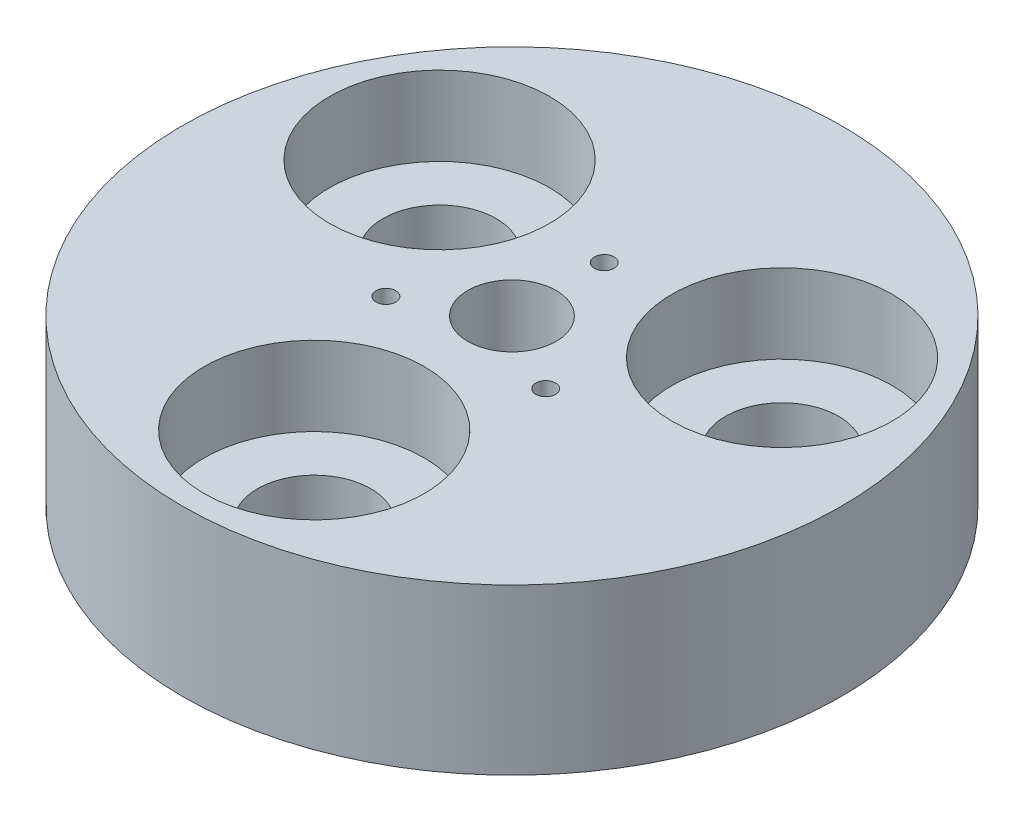
from build123d import *

# Parameters (mm, degrees)
SKETCH1_R                                           = 6.35
BOSS_EXTRUDE1_DEPTH                                 = 3.175
SKETCH5_R                                           = 0.1905
CUT_EXTRUDE3_DEPTH                                  = 1.905
CIRPATTERN3_COUNT                                   = 3
SKETCH6_R                                           = 0.8509
CUT_EXTRUDE4_DEPTH                                  = 3.175
CBORE_FOR_2_BINDING_HEAD_MACHINE_SCREW1_D           = 2.1844
CBORE_FOR_2_BINDING_HEAD_MACHINE_SCREW1_CBORE_D     = 4.2418
CBORE_FOR_2_BINDING_HEAD_MACHINE_SCREW1_CBORE_DEPTH = 1.524
CIRPATTERN4_COUNT                                   = 3


with BuildPart() as part:
    # Sketch1 → Boss-Extrude1 (new body)
    with BuildSketch(Plane(origin=(0, 0, 0), x_dir=(1, 0, 0), z_dir=(0, 1, 0))):
        with Locations(Location((0, 0, 0), (0, 0, 270))):
            Circle(SKETCH1_R)
    extrude(amount=BOSS_EXTRUDE1_DEPTH)

    # Sketch5 → Cut-Extrude3 (cut)
    with BuildSketch(Plane(origin=(0, 3.175, 0), x_dir=(1, 0, 0), z_dir=(0, 1, 0))):
        with Locations(Location((0, 1.778, 0), (0, 0, 270))):
            Circle(SKETCH5_R)
    cut_extrude3 = extrude(amount=-CUT_EXTRUDE3_DEPTH, mode=Mode.SUBTRACT)

    # CirPattern3: Cut-Extrude3 ×3 about axis
    cirpattern3_axis = Axis((0, 0, 0), (0, 1, 0))
    for i in range(1, CIRPATTERN3_COUNT):
        add(cut_extrude3.rotate(cirpattern3_axis, i * 360 / CIRPATTERN3_COUNT), mode=Mode.SUBTRACT)

    # Sketch6 → Cut-Extrude4 (cut)
    with BuildSketch(Plane(origin=(0, 3.175, 0), x_dir=(1, 0, 0), z_dir=(0, 1, 0))):
        with Locations(Location((0, 0, 0), (0, 0, 270))):
            Circle(SKETCH6_R)
    extrude(amount=-CUT_EXTRUDE4_DEPTH, mode=Mode.SUBTRACT)

    # CBORE for #2 Binding Head Machine Screw1 (through all)
    with Locations(Plane(origin=(0, 3.175, 0), x_dir=(1, 0, 0), z_dir=(0, 1, 0))):
        with Locations((0, -3.81)):
            cbore_for_2_binding_head_machine_screw1 = CounterBoreHole(CBORE_FOR_2_BINDING_HEAD_MACHINE_SCREW1_D / 2, CBORE_FOR_2_BINDING_HEAD_MACHINE_SCREW1_CBORE_D / 2, CBORE_FOR_2_BINDING_HEAD_MACHINE_SCREW1_CBORE_DEPTH)

    # CirPattern4: CBORE for #2 Binding Head Machine Screw1 ×3 about axis
    cirpattern4_axis = Axis((0, 0, 0), (0, 1, 0))
    for i in range(1, CIRPATTERN4_COUNT):
        add(cbore_for_2_binding_head_machine_screw1.rotate(cirpattern4_axis, i * 360 / CIRPATTERN4_COUNT), mode=Mode.SUBTRACT)


solid = part.part
